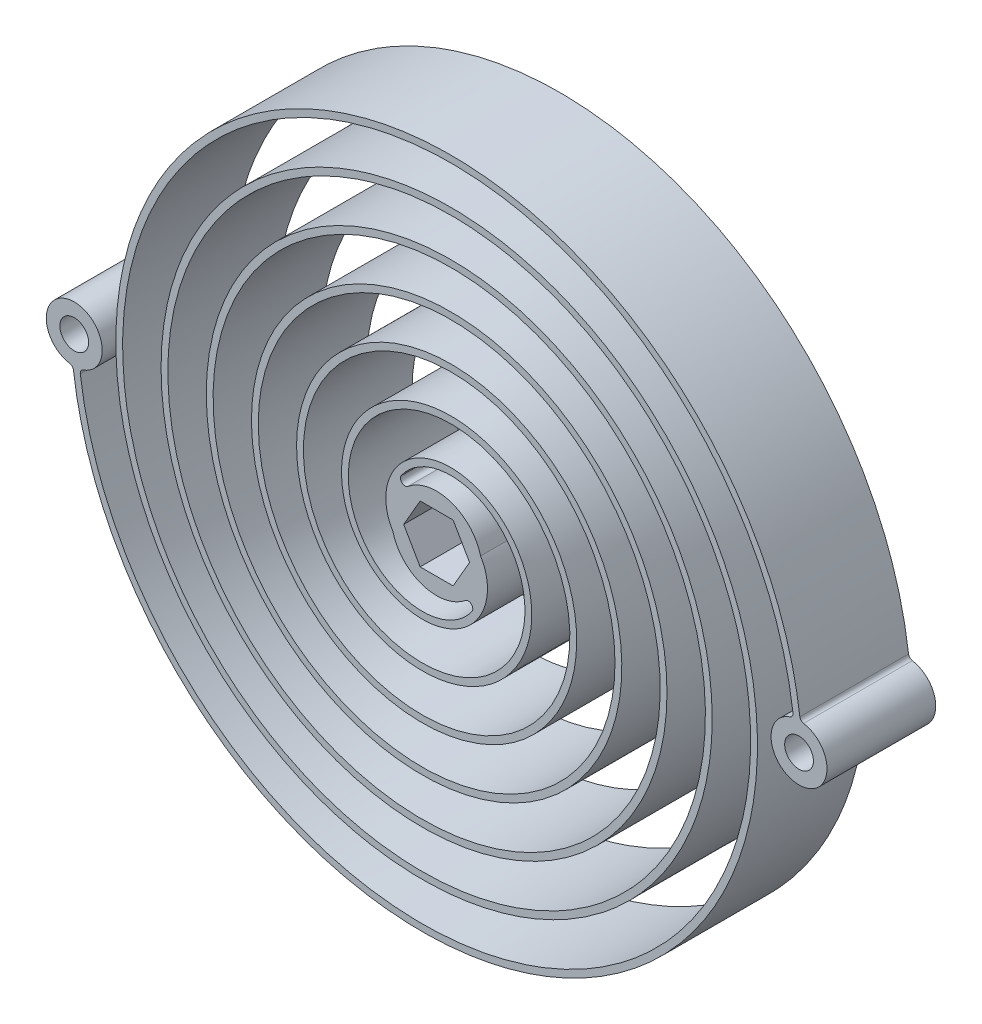
from build123d import *

# Parameters (mm, degrees)
SKETCH12_R          = 5
BOSS_EXTRUDE2_DEPTH = 12
SKETCH11_R          = 1.5875
BOSS_EXTRUDE1_DEPTH = 12
CIRPATTERN1_COUNT   = 2
FILLET1_R           = 0.5


with BuildPart() as part:
    # Sketch12 → Boss-Extrude2 (new body)
    with BuildSketch(Plane.XY):
        Circle(SKETCH12_R)
        Polygon((3.637306696, 0), (1.818653348, 3.15), (-1.818653348, 3.15), (-3.637306696, 0), (-1.818653348, -3.15), (1.818653348, -3.15), align=None, mode=Mode.SUBTRACT)
    extrude(amount=BOSS_EXTRUDE2_DEPTH)

    # Sketch11 → Boss-Extrude1 (add)
    with BuildSketch(Plane.XY):
        with BuildLine():
            ThreePointArc((4.848653849, -1.220883225), (4.999999168, -0.002884853), (4.850059448, 1.215287352))
            add(Edge.make_bspline(
                [(4.850059448, 1.215287352), (5.385344121, 0.363176303), (5.671445981, -0.73231997), (5.551454885, -2.599033935), (5.372341556, -3.325578307), (4.729898574, -4.71993743), (4.267809448, -5.384259922), (3.085008009, -6.543162734), (2.366646882, -7.034971338), (0.73966526, -7.750376006), (-0.165825634, -7.972230923), (-2.062172131, -8.077930871), (-3.049525613, -7.96124608), (-4.980340718, -7.361854817), (-5.920362997, -6.879866183), (-7.619590473, -5.571620603), (-8.375836341, -4.747220308), (-9.58200294, -2.827030726), (-10.029797842, -1.733997295), (-10.523862123, 0.605329915), (-10.569090022, 1.84831046), (-10.209123202, 4.336893057), (-9.804091964, 5.579028728), (-8.551675915, 7.901012883), (-7.705636864, 8.977661639), (-5.639745808, 10.81103145), (-4.422259022, 11.565206118), (-1.737902409, 12.625311162), (-0.274133495, 12.929657076), (2.735004319, 13.010684564), (4.27690814, 12.78693794), (7.250440134, 11.795524882), (8.678654858, 11.028643569), (11.2326163, 9.004583739), (12.355412426, 7.749316283), (14.131383142, 4.869796561), (14.782428073, 3.24835917), (15.496416242, -0.185809581), (15.558313029, -1.995153573), (15.042870923, -5.590514221), (14.465703597, -7.372972959), (12.699310459, -10.688477757), (11.511464692, -12.218220746), (8.63059577, -14.819208999), (6.940007261, -15.887804575), (3.231361372, -17.402310691), (1.21651211, -17.846549036), (-2.910650364, -18.016717028), (-5.019358083, -17.742162477), (-9.078217849, -16.463830088), (-11.024794261, -15.460826864), (-14.508388249, -12.805548777), (-16.042288099, -11.155228691), (-18.486566789, -7.371013443), (-19.394663769, -5.240032957), (-20.43937652, -0.729643386), (-20.574828674, 1.646228263), (-20.014344107, 6.367727087), (-19.318514192, 8.709609209), (-17.135617247, 13.073633632), (-15.649929903, 15.09226786), (-12.027504101, 18.545126343), (-9.893268996, 19.976500981), (-5.201367899, 22.049207877), (-2.647044087, 22.688696921), (2.594124666, 23.059433772), (5.277176731, 22.790076943), (10.454757679, 21.331107079), (12.945489433, 20.142215429), (17.425640087, 16.94468125), (19.411709925, 14.938016745), (22.617037111, 10.310567736), (23.833797934, 7.692798091), (25.317127158, 2.13312477), (25.582359523, -0.805073084), (25.087480693, -6.66336193), (24.327367608, -9.579488454), (21.828665788, -15.03902655), (20.091426409, -17.57868341), (15.806633228, -21.961333442), (13.261342093, -23.801373855), (9.041859766, -25.849254611), (7.569462899, -26.413702628), (4.533920158, -27.28477939), (2.971126207, -27.591296169), (-0.199927933, -27.932097904), (-1.807821877, -27.966332887), (-5.021533517, -27.756129624), (-6.626981488, -27.511704987), (-9.787404777, -26.74605998), (-11.342017854, -26.224916509), (-14.35297891, -24.916129708), (-15.808982889, -24.128624398), (-18.577003329, -22.305671868), (-19.888704267, -21.270419807), (-22.325895588, -18.978382015), (-23.451108334, -17.721842897), (-25.477947725, -15.020830398), (-26.379342922, -13.576647864), (-27.927243248, -10.540248575), (-28.573570067, -8.948358358), (-29.587161631, -5.661645748), (-29.954306588, -3.967175967), (-30.393355754, -0.524331648), (-30.465202358, 1.223674607), (-30.306102069, 4.722057627), (-30.075161577, 6.472061327), (-29.31194086, 9.921917587), (-28.779730972, 11.62140335), (-27.424544466, 14.91829021), (-26.601700157, 16.51534166), (-24.684773998, 19.557598851), (-23.590882628, 21.002482491), (-21.159909354, 23.694360435), (-19.823070567, 24.941069781), (-16.942062461, 27.195730585), (-15.398181792, 28.203442744), (-12.145808847, 29.945740169), (-10.43764229, 30.680138973), (-6.905097172, 31.849088943), (-5.081071822, 32.283512111), (-1.369519358, 32.834373441), (0.517637465, 32.950745972), (4.299955144, 32.856641639), (6.194739564, 32.64616358), (9.935659452, 31.899185873), (11.781423478, 31.362749629), (15.368187662, 29.974507384), (17.108832383, 29.122827633), (20.431484935, 27.124410185), (22.01316389, 25.977857969), (24.967916391, 23.419207886), (26.340697418, 22.007349359), (28.833160272, 18.956053944), (29.952594669, 17.316903273), (31.900773876, 13.856432692), (32.729323762, 12.035437494), (34.066288528, 8.262874702), (34.574566869, 6.311660778), (35.250702041, 2.334984546), (35.418484877, 0.309894453), (35.403253583, -3.75510866), (35.220230318, -5.794641904), (34.503386035, -9.827748414), (33.969621143, -11.820945569), (32.561824286, -15.701050628), (31.68791218, -17.587597226), (29.62072379, -21.196349737), (28.42762768, -22.918219875), (25.75287134, -26.143628091), (24.271446386, -27.646865916), (21.059948569, -30.386763795), (19.330159234, -31.623168076), (15.669897354, -33.788435357), (13.739748296, -34.717094726), (9.733454092, -36.234529685), (7.657662903, -36.823159919), (3.419946039, -37.637912882), (1.258394376, -37.86395295), (-3.087533443, -37.941440735), (-5.271526557, -37.792871061), (-9.597433385, -37.120107152), (-11.738966342, -36.595961448), (-15.915383611, -35.182253564), (-17.949900724, -34.292804535), (-21.849997046, -32.169789761), (-23.715233505, -30.936398571), (-27.218662768, -28.157405922), (-28.856547462, -26.612035384), (-31.853154583, -23.250785909), (-33.211612726, -21.435187545), (-35.604883159, -17.583862284), (-36.639482902, -15.548457417), (-38.349628277, -11.315183081), (-39.025019494, -9.117667657), (-39.776876283, -5.621865043), (-39.986092343, -4.357959026), (-40.13477382, -3.084557062)],
                knots=[-0.010046471, -0.010046471, -0.010046471, -0.010046471, 0.015625, 0.015625, 0.03125, 0.03125, 0.046875, 0.046875, 0.0625, 0.0625, 0.078125, 0.078125, 0.09375, 0.09375, 0.109375, 0.109375, 0.125, 0.125, 0.140625, 0.140625, 0.15625, 0.15625, 0.171875, 0.171875, 0.1875, 0.1875, 0.203125, 0.203125, 0.21875, 0.21875, 0.234375, 0.234375, 0.25, 0.25, 0.265625, 0.265625, 0.28125, 0.28125, 0.296875, 0.296875, 0.3125, 0.3125, 0.328125, 0.328125, 0.34375, 0.34375, 0.359375, 0.359375, 0.375, 0.375, 0.390625, 0.390625, 0.40625, 0.40625, 0.421875, 0.421875, 0.4375, 0.4375, 0.453125, 0.453125, 0.46875, 0.46875, 0.484375, 0.484375, 0.5, 0.5, 0.515625, 0.515625, 0.53125, 0.53125, 0.546875, 0.546875, 0.5625, 0.5625, 0.578125, 0.578125, 0.59375, 0.59375, 0.609375, 0.609375, 0.625, 0.625, 0.6328125, 0.6328125, 0.640625, 0.640625, 0.6484375, 0.6484375, 0.65625, 0.65625, 0.6640625, 0.6640625, 0.671875, 0.671875, 0.6796875, 0.6796875, 0.6875, 0.6875, 0.6953125, 0.6953125, 0.703125, 0.703125, 0.7109375, 0.7109375, 0.71875, 0.71875, 0.7265625, 0.7265625, 0.734375, 0.734375, 0.7421875, 0.7421875, 0.75, 0.75, 0.7578125, 0.7578125, 0.765625, 0.765625, 0.7734375, 0.7734375, 0.78125, 0.78125, 0.7890625, 0.7890625, 0.796875, 0.796875, 0.8046875, 0.8046875, 0.8125, 0.8125, 0.8203125, 0.8203125, 0.828125, 0.828125, 0.8359375, 0.8359375, 0.84375, 0.84375, 0.8515625, 0.8515625, 0.859375, 0.859375, 0.8671875, 0.8671875, 0.875, 0.875, 0.8828125, 0.8828125, 0.890625, 0.890625, 0.8984375, 0.8984375, 0.90625, 0.90625, 0.9140625, 0.9140625, 0.921875, 0.921875, 0.9296875, 0.9296875, 0.9375, 0.9375, 0.9453125, 0.9453125, 0.953125, 0.953125, 0.9609375, 0.9609375, 0.96875, 0.96875, 0.9765625, 0.9765625, 0.984375, 0.984375, 0.9921875, 0.9921875, 0.996528924, 0.996528924, 0.996528924, 0.996528924], degree=3))
            ThreePointArc((-40.13477382, -3.084557062), (-40.241147021, 3.078068285), (-39.386508078, -3.025935213))
            add(Edge.make_bspline(
                [(4.848653849, -1.220883225), (4.861700809, -1.425036706), (4.861970362, -1.633508465), (4.809002639, -2.457532838), (4.652460487, -3.095737928), (4.087429184, -4.322082637), (3.677459047, -4.912682756), (2.625577639, -5.943310792), (1.981486018, -6.38502821), (0.521048598, -7.027201258), (-0.297844592, -7.228425343), (-2.013631696, -7.32406114), (-2.913094606, -7.218291475), (-4.672055971, -6.67224951), (-5.533824544, -6.230931394), (-7.0910586, -5.032007413), (-7.788233168, -4.272672882), (-8.899410021, -2.503704798), (-9.31438194, -1.491910567), (-9.771652763, 0.673204622), (-9.814102208, 1.828831101), (-9.479561127, 4.141636243), (-9.101924554, 5.30097694), (-7.933639422, 7.466982054), (-7.14166465, 8.475409033), (-5.208075955, 10.191367448), (-4.064647515, 10.90006654), (-1.544543518, 11.895305006), (-0.16580619, 12.182302168), (2.667053096, 12.258582979), (4.123224565, 12.047589763), (6.929680534, 11.111881958), (8.281755804, 10.386220039), (10.697846003, 8.471425618), (11.763188121, 7.280816923), (13.446904012, 4.550877139), (14.066000693, 3.009739857), (14.744248139, -0.25252174), (14.803454978, -1.975552178), (14.312910095, -5.397247354), (13.762567404, -7.097685553), (12.078606324, -10.258466087), (10.943846331, -11.720241923), (8.193016097, -14.203824939), (6.575412045, -15.22656737), (3.028862959, -16.674877735), (1.098190953, -17.100790328), (-2.854123551, -17.263749123), (-4.877471925, -17.000531414), (-8.769500989, -15.774742129), (-10.639663231, -14.811353673), (-13.984213699, -12.26205786), (-15.459690852, -10.674900279), (-17.809151457, -7.03748173), (-18.683716635, -4.985703987), (-19.689010895, -0.645497807), (-19.819765287, 1.644521865), (-19.279865965, 6.192611449), (-18.608700628, 8.452153722), (-16.503898831, 12.660051155), (-15.069296936, 14.609588519), (-11.573194016, 17.942037348), (-9.510407982, 19.325711356), (-4.978095373, 21.32791801), (-2.50713136, 21.946719745), (2.560050782, 22.305149561), (5.157680195, 22.044541858), (10.167418754, 20.63286763), (12.580745026, 19.481110262), (16.918991647, 16.384854596), (18.844797415, 14.43931293), (21.950874453, 9.955148826), (23.131607735, 7.415271177), (24.570013613, 2.023975261), (24.827688176, -0.828749863), (24.347475582, -6.513422388), (23.609150911, -9.346568832), (21.182946079, -14.647704648), (19.494261775, -17.116645881), (15.33123102, -21.374752656), (12.856122388, -23.164376751), (8.753259729, -25.155657394), (7.321061915, -25.704714781), (4.368580327, -26.551956385), (2.84802683, -26.850207033), (-0.237114576, -27.181775496), (-1.801979048, -27.215112428), (-4.92947317, -27.010548503), (-6.492378007, -26.772619079), (-9.568833996, -26.027316014), (-11.082650816, -25.519867162), (-14.014382317, -24.245519397), (-15.432545322, -23.478501044), (-18.12842038, -21.70306175), (-19.406356135, -20.694480855), (-21.780622156, -18.461620678), (-22.877144981, -17.237145826), (-24.85214139, -14.605220468), (-25.73077082, -13.197544708), (-27.23944403, -10.238094293), (-27.869602478, -8.686071482), (-28.857742374, -5.481889468), (-29.215794086, -3.829466641), (-29.643918472, -0.472289986), (-29.714015104, 1.232735072), (-29.558838124, 4.644850245), (-29.333541639, 6.352211146), (-28.588973933, 9.717753388), (-28.069633872, 11.376197063), (-26.747275751, 14.593219289), (-25.944145106, 16.152043995), (-24.073248993, 19.121249212), (-23.005330696, 20.531852486), (-20.63222497, 23.159652237), (-19.326849145, 24.37704159), (-16.513831965, 26.578493077), (-15.005972359, 27.562712616), (-11.829700447, 29.264242689), (-10.161046606, 29.981670645), (-6.710459852, 31.123499879), (-4.928269352, 31.547975282), (-1.302106999, 32.086163179), (0.542130815, 32.19990448), (4.238153233, 32.107947179), (6.090204279, 31.902231394), (9.746476623, 31.172155901), (11.550956965, 30.647733709), (15.057224957, 29.290647183), (16.759256627, 28.457877087), (20.007944722, 26.50394574), (21.554822992, 25.382638747), (24.444329557, 22.880487989), (25.787151053, 21.499462964), (28.225015068, 18.515007938), (29.320216548, 16.911366655), (31.22605743, 13.526099897), (32.036816993, 11.744239477), (33.34495459, 8.053019373), (33.842410583, 6.143408115), (34.504080714, 2.25180775), (34.668328474, 0.269557937), (34.653420515, -3.709151784), (34.474253262, -5.705873794), (33.772509711, -9.654020629), (33.249877237, -11.605701201), (31.871510717, -15.404691714), (31.015677691, -17.252243522), (28.991377974, -20.786123996), (27.822772588, -22.472673557), (25.203094342, -25.631664756), (23.75184732, -27.104299877), (20.605988039, -29.788198064), (18.911171436, -30.999621595), (15.325167697, -33.120960673), (13.433752188, -34.030999057), (9.508140449, -35.517874504), (7.473698652, -36.094793295), (3.320703755, -36.893257422), (1.201895214, -37.114841123), (-3.057774993, -37.190790937), (-5.198894394, -37.045151088), (-9.439556868, -36.38564436), (-11.539352353, -35.871727543), (-15.634057166, -34.485679143), (-17.629206152, -33.613455293), (-21.45353589, -31.531684008), (-23.28293652, -30.322004865), (-26.718783095, -27.596620204), (-28.325422722, -26.080747581), (-31.264627038, -22.783885974), (-32.5973536, -21.002699558), (-34.945096153, -17.224639177), (-35.960237555, -15.227543399), (-37.638074053, -11.074246091), (-38.300854538, -8.917805007), (-39.036610549, -5.49686391), (-39.240806875, -4.266026759), (-39.386508078, -3.025935213)],
                knots=[0.010242759, 0.010242759, 0.010242759, 0.010242759, 0.015625, 0.015625, 0.03125, 0.03125, 0.046875, 0.046875, 0.0625, 0.0625, 0.078125, 0.078125, 0.09375, 0.09375, 0.109375, 0.109375, 0.125, 0.125, 0.140625, 0.140625, 0.15625, 0.15625, 0.171875, 0.171875, 0.1875, 0.1875, 0.203125, 0.203125, 0.21875, 0.21875, 0.234375, 0.234375, 0.25, 0.25, 0.265625, 0.265625, 0.28125, 0.28125, 0.296875, 0.296875, 0.3125, 0.3125, 0.328125, 0.328125, 0.34375, 0.34375, 0.359375, 0.359375, 0.375, 0.375, 0.390625, 0.390625, 0.40625, 0.40625, 0.421875, 0.421875, 0.4375, 0.4375, 0.453125, 0.453125, 0.46875, 0.46875, 0.484375, 0.484375, 0.5, 0.5, 0.515625, 0.515625, 0.53125, 0.53125, 0.546875, 0.546875, 0.5625, 0.5625, 0.578125, 0.578125, 0.59375, 0.59375, 0.609375, 0.609375, 0.625, 0.625, 0.6328125, 0.6328125, 0.640625, 0.640625, 0.6484375, 0.6484375, 0.65625, 0.65625, 0.6640625, 0.6640625, 0.671875, 0.671875, 0.6796875, 0.6796875, 0.6875, 0.6875, 0.6953125, 0.6953125, 0.703125, 0.703125, 0.7109375, 0.7109375, 0.71875, 0.71875, 0.7265625, 0.7265625, 0.734375, 0.734375, 0.7421875, 0.7421875, 0.75, 0.75, 0.7578125, 0.7578125, 0.765625, 0.765625, 0.7734375, 0.7734375, 0.78125, 0.78125, 0.7890625, 0.7890625, 0.796875, 0.796875, 0.8046875, 0.8046875, 0.8125, 0.8125, 0.8203125, 0.8203125, 0.828125, 0.828125, 0.8359375, 0.8359375, 0.84375, 0.84375, 0.8515625, 0.8515625, 0.859375, 0.859375, 0.8671875, 0.8671875, 0.875, 0.875, 0.8828125, 0.8828125, 0.890625, 0.890625, 0.8984375, 0.8984375, 0.90625, 0.90625, 0.9140625, 0.9140625, 0.921875, 0.921875, 0.9296875, 0.9296875, 0.9375, 0.9375, 0.9453125, 0.9453125, 0.953125, 0.953125, 0.9609375, 0.9609375, 0.96875, 0.96875, 0.9765625, 0.9765625, 0.984375, 0.984375, 0.9921875, 0.9921875, 0.996496085, 0.996496085, 0.996496085, 0.996496085], degree=3))
        make_face()
        with Locations((-40, 0)):
            Circle(SKETCH11_R, mode=Mode.SUBTRACT)
    extrude(amount=BOSS_EXTRUDE1_DEPTH)

    # CirPattern1: part ×2 about axis
    cirpattern1_axis = Axis((0, 0, -61.53329394), (0, 0, 1))


with BuildPart() as part_1:
    add(part.part)
    for i in range(1, CIRPATTERN1_COUNT):
        add(part.part.rotate(cirpattern1_axis, i * 360 / CIRPATTERN1_COUNT))

    # Fillet1
    fillet1_edges = [part_1.edges().sort_by_distance(p)[0] for p in [
        (39.386508078, 3.025935213, 6),
        (40.13477382, 3.084557062, 6),
        (4.848653849, -1.220883225, 6),
        (-4.848653849, 1.220883225, 6),
        (-39.386508078, -3.025935213, 6),
        (-40.13477382, -3.084557062, 6),
    ]]
    fillet(fillet1_edges, radius=FILLET1_R)


solid = part_1.part
